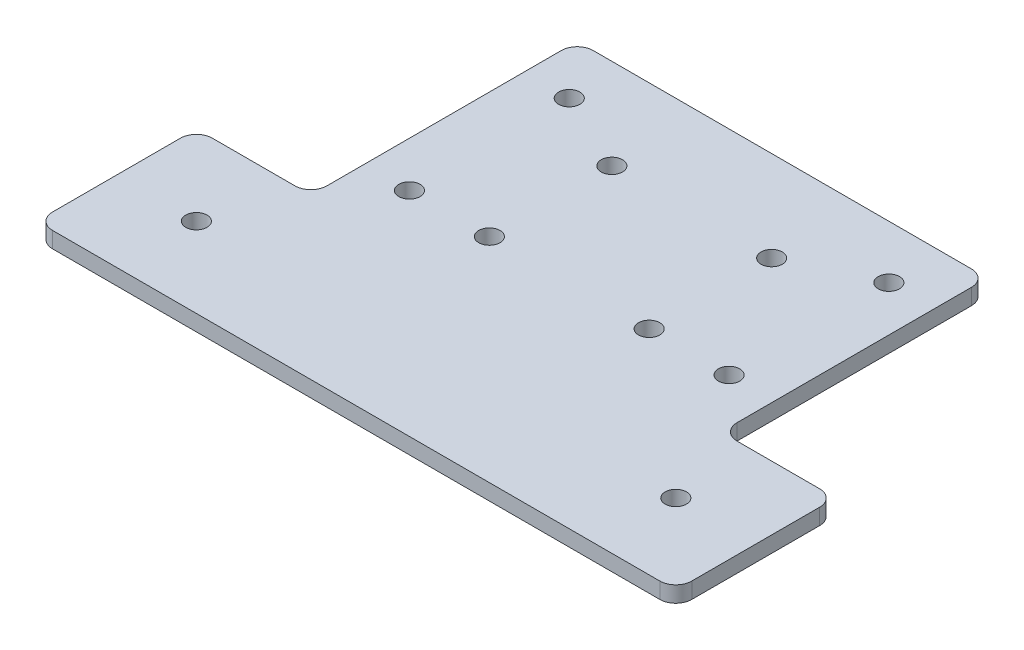
from build123d import *

# Parameters (mm, degrees)
SZKIC1_W                    = 77
SZKIC1_H                    = 80
DODANIE_WYCI_GNI_CIE1_DEPTH = 3
WYTNIJ_WYCI_GNI_CIE1_REACH  = 57.599
SZKIC2_R                    = 2.5
SZKIC2_R_2                  = 2
ZAOKR_GLENIE1_R             = 3
ZAOKR_GLENIE2_R             = 3
WYTNIJ_WYCI_GNI_CIE3_REACH  = 57.599
SZKIC3_R                    = 2
SZKIC5_W                    = 120
SZKIC5_H                    = 30
DODANIE_WYCI_GNI_CIE2_DEPTH = 3
ZAOKR_GLENIE4_R             = 3
WYTNIJ_WYCI_GNI_CIE4_REACH  = 74.173
SZKIC6_R                    = 2


with BuildPart() as part:
    # Szkic1 → Dodanie-wyciągnięcie1 (new body)
    with BuildSketch(Plane(origin=(0, 0, 0), x_dir=(1, 0, 0), z_dir=(0, 1, 0))):
        Rectangle(SZKIC1_W, SZKIC1_H)
    extrude(amount=DODANIE_WYCI_GNI_CIE1_DEPTH)

    # Szkic2 → Wytnij-wyciągnięcie1 (cut, up to next)
    with BuildSketch(Plane(origin=(0, 3, 0), x_dir=(1, 0, 0), z_dir=(0, 1, 0)), mode=Mode.PRIVATE) as wytnij_wyci_gni_cie1_sk1:
        with Locations(Location((-23.5, -25, 0), (0, 0, 270))):
            Circle(SZKIC2_R)
    wytnij_wyci_gni_cie1_tool1 = extrude(wytnij_wyci_gni_cie1_sk1.sketch, amount=-WYTNIJ_WYCI_GNI_CIE1_REACH, mode=Mode.PRIVATE) & part.part
    # Szkic2 → Wytnij-wyciągnięcie1 (cut, up to next)
    with BuildSketch(Plane(origin=(0, 3, 0), x_dir=(1, 0, 0), z_dir=(0, 1, 0)), mode=Mode.PRIVATE) as wytnij_wyci_gni_cie1_sk2:
        with Locations(Location((23.5, -25, 0), (0, 0, 270))):
            Circle(SZKIC2_R)
    wytnij_wyci_gni_cie1_tool2 = extrude(wytnij_wyci_gni_cie1_sk2.sketch, amount=-WYTNIJ_WYCI_GNI_CIE1_REACH, mode=Mode.PRIVATE) & part.part
    # Szkic2 → Wytnij-wyciągnięcie1 (cut, up to next)
    with BuildSketch(Plane(origin=(0, 3, 0), x_dir=(1, 0, 0), z_dir=(0, 1, 0)), mode=Mode.PRIVATE) as wytnij_wyci_gni_cie1_sk3:
        with Locations(Location((-30, 30, 0), (0, 0, 270))):
            Circle(SZKIC2_R_2)
    wytnij_wyci_gni_cie1_tool3 = extrude(wytnij_wyci_gni_cie1_sk3.sketch, amount=-WYTNIJ_WYCI_GNI_CIE1_REACH, mode=Mode.PRIVATE) & part.part
    # Szkic2 → Wytnij-wyciągnięcie1 (cut, up to next)
    with BuildSketch(Plane(origin=(0, 3, 0), x_dir=(1, 0, 0), z_dir=(0, 1, 0)), mode=Mode.PRIVATE) as wytnij_wyci_gni_cie1_sk4:
        with Locations(Location((-30, 0, 0), (0, 0, 270))):
            Circle(SZKIC2_R_2)
    wytnij_wyci_gni_cie1_tool4 = extrude(wytnij_wyci_gni_cie1_sk4.sketch, amount=-WYTNIJ_WYCI_GNI_CIE1_REACH, mode=Mode.PRIVATE) & part.part
    # Szkic2 → Wytnij-wyciągnięcie1 (cut, up to next)
    with BuildSketch(Plane(origin=(0, 3, 0), x_dir=(1, 0, 0), z_dir=(0, 1, 0)), mode=Mode.PRIVATE) as wytnij_wyci_gni_cie1_sk5:
        with Locations(Location((30, 0, 0), (0, 0, 270))):
            Circle(SZKIC2_R_2)
    wytnij_wyci_gni_cie1_tool5 = extrude(wytnij_wyci_gni_cie1_sk5.sketch, amount=-WYTNIJ_WYCI_GNI_CIE1_REACH, mode=Mode.PRIVATE) & part.part
    # Szkic2 → Wytnij-wyciągnięcie1 (cut, up to next)
    with BuildSketch(Plane(origin=(0, 3, 0), x_dir=(1, 0, 0), z_dir=(0, 1, 0)), mode=Mode.PRIVATE) as wytnij_wyci_gni_cie1_sk6:
        with Locations(Location((30, 30, 0), (0, 0, 270))):
            Circle(SZKIC2_R_2)
    wytnij_wyci_gni_cie1_tool6 = extrude(wytnij_wyci_gni_cie1_sk6.sketch, amount=-WYTNIJ_WYCI_GNI_CIE1_REACH, mode=Mode.PRIVATE) & part.part
    add(wytnij_wyci_gni_cie1_tool1.solids().sort_by_distance((-23.5, 3, 25))[0], mode=Mode.SUBTRACT)
    add(wytnij_wyci_gni_cie1_tool2.solids().sort_by_distance((23.5, 3, 25))[0], mode=Mode.SUBTRACT)
    add(wytnij_wyci_gni_cie1_tool3.solids().sort_by_distance((-30, 3, -30))[0], mode=Mode.SUBTRACT)
    add(wytnij_wyci_gni_cie1_tool4.solids().sort_by_distance((-30, 3, 0))[0], mode=Mode.SUBTRACT)
    add(wytnij_wyci_gni_cie1_tool5.solids().sort_by_distance((30, 3, 0))[0], mode=Mode.SUBTRACT)
    add(wytnij_wyci_gni_cie1_tool6.solids().sort_by_distance((30, 3, -30))[0], mode=Mode.SUBTRACT)

    # Zaokrąglenie1
    zaokr_glenie1_edges = [part.edges().sort_by_distance(p)[0] for p in [
        (-38.5, 1.5, -40),
    ]]
    fillet(zaokr_glenie1_edges, radius=ZAOKR_GLENIE1_R)

    # Zaokrąglenie2
    zaokr_glenie2_edges = [part.edges().sort_by_distance(p)[0] for p in [
        (38.5, 1.5, 40),
        (-38.5, 1.5, 40),
        (38.5, 1.5, -40),
    ]]
    fillet(zaokr_glenie2_edges, radius=ZAOKR_GLENIE2_R)

    # Szkic3 → Wytnij-wyciągnięcie3 (cut, up to next)
    with BuildSketch(Plane(origin=(0, 0, 0), x_dir=(1, 0, 0), z_dir=(0, 1, 0)), mode=Mode.PRIVATE) as wytnij_wyci_gni_cie3_sk1:
        with Locations(Location((-15, 23, 0), (0, 0, 90))):
            Circle(SZKIC3_R)
    wytnij_wyci_gni_cie3_tool1 = extrude(wytnij_wyci_gni_cie3_sk1.sketch, amount=WYTNIJ_WYCI_GNI_CIE3_REACH, mode=Mode.PRIVATE) & part.part
    # Szkic3 → Wytnij-wyciągnięcie3 (cut, up to next)
    with BuildSketch(Plane(origin=(0, 0, 0), x_dir=(1, 0, 0), z_dir=(0, 1, 0)), mode=Mode.PRIVATE) as wytnij_wyci_gni_cie3_sk2:
        with Locations(Location((15, 23, 0), (0, 0, 90))):
            Circle(SZKIC3_R)
    wytnij_wyci_gni_cie3_tool2 = extrude(wytnij_wyci_gni_cie3_sk2.sketch, amount=WYTNIJ_WYCI_GNI_CIE3_REACH, mode=Mode.PRIVATE) & part.part
    # Szkic3 → Wytnij-wyciągnięcie3 (cut, up to next)
    with BuildSketch(Plane(origin=(0, 0, 0), x_dir=(1, 0, 0), z_dir=(0, 1, 0)), mode=Mode.PRIVATE) as wytnij_wyci_gni_cie3_sk3:
        with Locations(Location((-15, 0, 0), (0, 0, 90))):
            Circle(SZKIC3_R)
    wytnij_wyci_gni_cie3_tool3 = extrude(wytnij_wyci_gni_cie3_sk3.sketch, amount=WYTNIJ_WYCI_GNI_CIE3_REACH, mode=Mode.PRIVATE) & part.part
    # Szkic3 → Wytnij-wyciągnięcie3 (cut, up to next)
    with BuildSketch(Plane(origin=(0, 0, 0), x_dir=(1, 0, 0), z_dir=(0, 1, 0)), mode=Mode.PRIVATE) as wytnij_wyci_gni_cie3_sk4:
        with Locations(Location((15, 0, 0), (0, 0, 90))):
            Circle(SZKIC3_R)
    wytnij_wyci_gni_cie3_tool4 = extrude(wytnij_wyci_gni_cie3_sk4.sketch, amount=WYTNIJ_WYCI_GNI_CIE3_REACH, mode=Mode.PRIVATE) & part.part
    add(wytnij_wyci_gni_cie3_tool1.solids().sort_by_distance((-15, 0, -23))[0], mode=Mode.SUBTRACT)
    add(wytnij_wyci_gni_cie3_tool2.solids().sort_by_distance((15, 0, -23))[0], mode=Mode.SUBTRACT)
    add(wytnij_wyci_gni_cie3_tool3.solids().sort_by_distance((-15, 0, 0))[0], mode=Mode.SUBTRACT)
    add(wytnij_wyci_gni_cie3_tool4.solids().sort_by_distance((15, 0, 0))[0], mode=Mode.SUBTRACT)

    # Szkic5 → Dodanie-wyciągnięcie2 (add)
    with BuildSketch(Plane(origin=(0, 3, 0), x_dir=(1, 0, 0), z_dir=(0, 1, 0))):
        with Locations((0, -25)):
            Rectangle(SZKIC5_W, SZKIC5_H)
    extrude(amount=-DODANIE_WYCI_GNI_CIE2_DEPTH)

    # Zaokrąglenie4
    zaokr_glenie4_edges = [part.edges().sort_by_distance(p)[0] for p in [
        (-60, 1.5, 10),
        (60, 1.5, 40),
        (-60, 1.5, 40),
        (38.5, 1.5, 10),
        (-38.5, 1.5, 10),
        (60, 1.5, 10),
    ]]
    fillet(zaokr_glenie4_edges, radius=ZAOKR_GLENIE4_R)

    # Szkic6 → Wytnij-wyciągnięcie4 (cut, up to next)
    with BuildSketch(Plane(origin=(0, 3, 0), x_dir=(1, 0, 0), z_dir=(0, 1, 0)), mode=Mode.PRIVATE) as wytnij_wyci_gni_cie4_sk1:
        with Locations(Location((-45, -25, 0), (0, 0, 270))):
            Circle(SZKIC6_R)
    wytnij_wyci_gni_cie4_tool1 = extrude(wytnij_wyci_gni_cie4_sk1.sketch, amount=-WYTNIJ_WYCI_GNI_CIE4_REACH, mode=Mode.PRIVATE) & part.part
    # Szkic6 → Wytnij-wyciągnięcie4 (cut, up to next)
    with BuildSketch(Plane(origin=(0, 3, 0), x_dir=(1, 0, 0), z_dir=(0, 1, 0)), mode=Mode.PRIVATE) as wytnij_wyci_gni_cie4_sk2:
        with Locations(Location((45, -25, 0), (0, 0, 270))):
            Circle(SZKIC6_R)
    wytnij_wyci_gni_cie4_tool2 = extrude(wytnij_wyci_gni_cie4_sk2.sketch, amount=-WYTNIJ_WYCI_GNI_CIE4_REACH, mode=Mode.PRIVATE) & part.part
    add(wytnij_wyci_gni_cie4_tool1.solids().sort_by_distance((-45, 3, 25))[0], mode=Mode.SUBTRACT)
    add(wytnij_wyci_gni_cie4_tool2.solids().sort_by_distance((45, 3, 25))[0], mode=Mode.SUBTRACT)


solid = part.part
